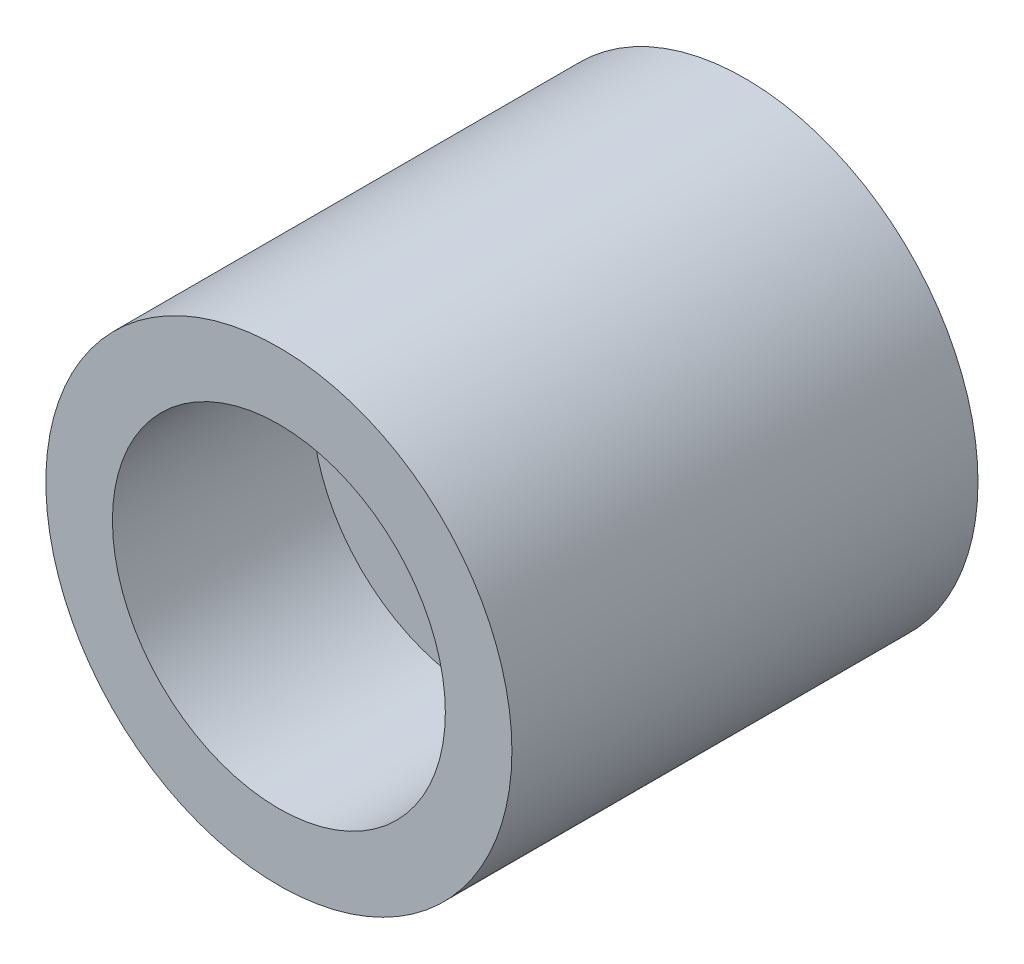
from build123d import *

# Parameters (mm, degrees)
SKETCH1_R           = 88.9
BOSS_EXTRUDE1_DEPTH = 177.8
SKETCH2_R           = 63.5
CUT_EXTRUDE1_DEPTH  = 76.2
CUT_EXTRUDE2_START  = -76.2
SKETCH3_R           = 63.5
CUT_EXTRUDE2_DEPTH  = 76.2


with BuildPart() as part:
    # Sketch1 → Boss-Extrude1 (new body)
    with BuildSketch(Plane.XY):
        Circle(SKETCH1_R)
    extrude(amount=BOSS_EXTRUDE1_DEPTH)

    # Sketch2 → Cut-Extrude1 (cut)
    with BuildSketch(Plane.XY.offset(177.8)):
        Circle(SKETCH2_R)
    extrude(amount=-CUT_EXTRUDE1_DEPTH, mode=Mode.SUBTRACT)

    # Sketch3 → Cut-Extrude2 (cut)
    with BuildSketch(Plane(origin=(0, 0, 0), x_dir=(-1, 0, 0), z_dir=(0, 0, -1)).offset(CUT_EXTRUDE2_START)):
        with Locations(Location((0, 0, 0), (0, 0, 180))):
            Circle(SKETCH3_R)
    extrude(amount=CUT_EXTRUDE2_DEPTH, mode=Mode.SUBTRACT)


solid = part.part
